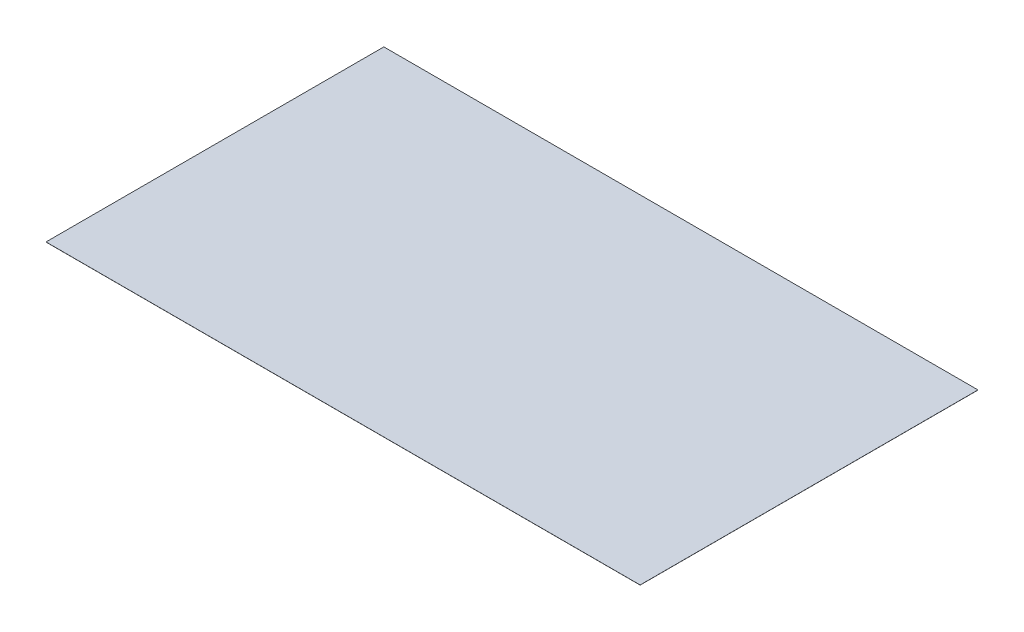
from build123d import *

# Parameters (mm, degrees)
SKETCH_1_W      = 5100
SKETCH_1_H      = 2900
EXTRUDE_1_DEPTH = 1


with BuildPart() as part:
    # Эскиз1 → Бобышка-Вытянуть1 (new body)
    with BuildSketch(Plane(origin=(0, 0, 0), x_dir=(1, 0, 0), z_dir=(0, 1, 0))):
        with Locations((-2550, -1450)):
            Rectangle(SKETCH_1_W, SKETCH_1_H)
    extrude(amount=EXTRUDE_1_DEPTH)


solid = part.part
